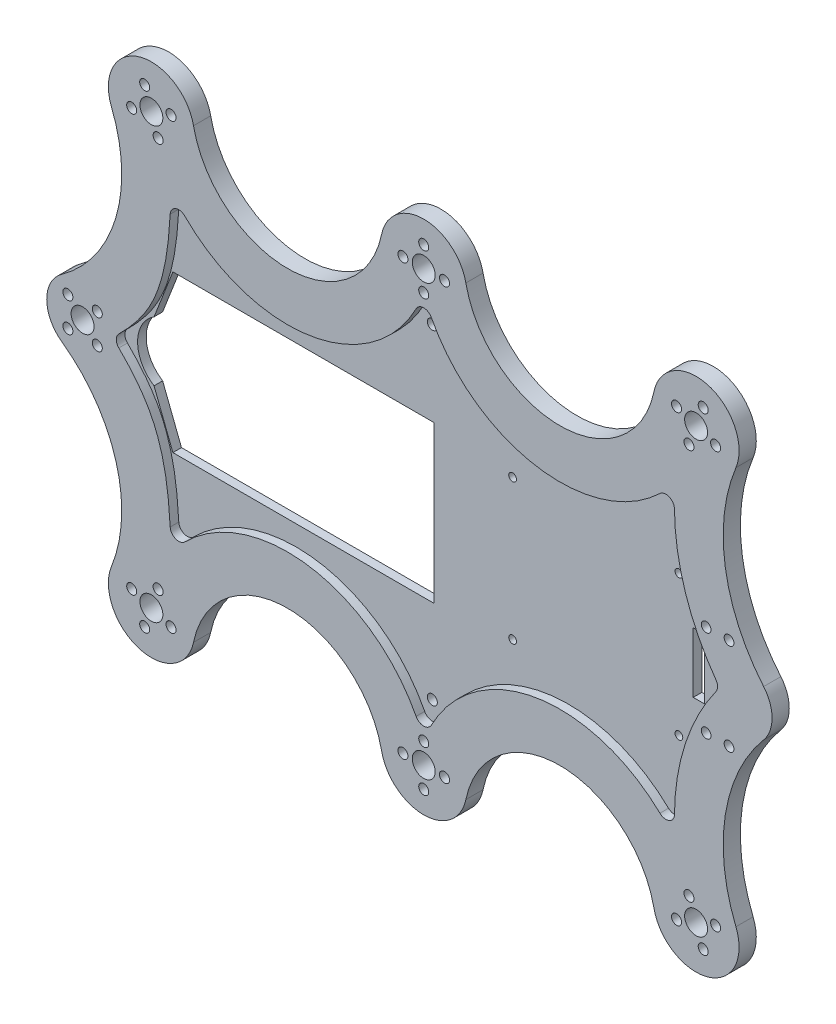
from build123d import *

# Parameters (mm, degrees)
BOSS_EXTRUDE1_DEPTH = 6
SKETCH3_R           = 2.2
SKETCH3_R_2         = 1.75
SKETCH3_R_3         = 1.7
CUT_EXTRUDE1_DEPTH  = 328.881898321
SKETCH4_R           = 1.75
SKETCH4_R_2         = 4
SKETCH4_R_3         = 2.2
SKETCH4_R_4         = 1.7
CUT_EXTRUDE2_DEPTH  = 328.881898321
SKETCH7_R           = 1.75
CUT_EXTRUDE3_DEPTH  = 3
SKETCH8_R           = 1.75
CUT_EXTRUDE4_DEPTH  = 328.881898461
BOSS_EXTRUDE2_DEPTH = 3
SKETCH12_W          = 68
SKETCH12_H          = 54.6
CUT_EXTRUDE5_DEPTH  = 328.840722513
SKETCH13_W          = 14
SKETCH13_H          = 54.6
CUT_EXTRUDE6_DEPTH  = 328.840722513
SKETCH14_W          = 4
SKETCH14_H          = 21
CUT_EXTRUDE7_DEPTH  = 328.840722513
SKETCH15_R          = 1.35
CUT_EXTRUDE8_DEPTH  = 328.840722513
SKETCH16_W          = 9.01
SKETCH16_H          = 54.6
CUT_EXTRUDE9_DEPTH  = 328.840722513
CUT_EXTRUDE10_DEPTH = 10
CUT_EXTRUDE11_DEPTH = 10


with BuildPart() as part:
    # Sketch2 → Boss-Extrude1 (new body)
    with BuildSketch(Plane.XY):
        with BuildLine():
            ThreePointArc((70.488766635, -192.322090702), (73.427413041, -184.270350675), (70.488766635, -176.218610648))
            ThreePointArc((70.488766635, -176.218610648), (57.116456448, -146.921490333), (60.81858321, -114.930332244))
            ThreePointArc((60.81858321, -114.930332244), (51.290904104, -94.919046005), (32.236691392, -106.240054086))
            ThreePointArc((32.236691392, -106.240054086), (-0.572586959, -132.972391704), (-33.381865309, -106.240054086))
            ThreePointArc((-33.381865309, -106.240054086), (-48.072586959, -94.270350675), (-62.763308608, -106.240054086))
            ThreePointArc((-62.763308608, -106.240054086), (-95.572586959, -132.972391704), (-128.381865309, -106.240054086))
            ThreePointArc((-128.381865309, -106.240054086), (-147.391756294, -94.905644752), (-156.998435737, -114.844463682))
            ThreePointArc((-156.998435737, -114.844463682), (-155.431011301, -147.469607154), (-174.3416559, -174.101248614))
            ThreePointArc((-174.3416559, -174.101248614), (-179.572586959, -184.270350675), (-174.3416559, -194.439452736))
            ThreePointArc((-174.3416559, -194.439452736), (-155.431011301, -221.071094196), (-156.998435737, -253.696237669))
            ThreePointArc((-156.998435737, -253.696237669), (-147.391756294, -273.635056598), (-128.381865309, -262.300647264))
            ThreePointArc((-128.381865309, -262.300647264), (-95.572586959, -235.568309646), (-62.763308608, -262.300647264))
            ThreePointArc((-62.763308608, -262.300647264), (-48.072586959, -274.270350675), (-33.381865309, -262.300647264))
            ThreePointArc((-33.381865309, -262.300647264), (-0.572586959, -235.568309646), (32.236691392, -262.300647264))
            ThreePointArc((32.236691392, -262.300647264), (51.290904104, -273.621655346), (60.81858321, -253.610369107))
            ThreePointArc((60.81858321, -253.610369107), (57.116456448, -221.619211017), (70.488766635, -192.322090702))
        make_face()
    extrude(amount=BOSS_EXTRUDE1_DEPTH)

    # Sketch3 → Cut-Extrude1 (cut, through all)
    with BuildSketch(Plane.XY.offset(6)):
        with Locations((-167.072586959, -184.270350675)):
            Circle(SKETCH3_R)
        with Locations((-143.072586959, -259.270350675)):
            Circle(SKETCH3_R)
        with Locations((-48.072586959, -259.270350675)):
            Circle(SKETCH3_R)
        with Locations((46.927413041, -259.270350675)):
            Circle(SKETCH3_R)
        with Locations((-67.072586959, -160.100350675)):
            Circle(SKETCH3_R_2)
        with Locations((-67.072586959, -208.440350675)):
            Circle(SKETCH3_R_2)
        with Locations((15.557413041, -208.440350675)):
            Circle(SKETCH3_R_2)
        with Locations((8.057413041, -160.100350675)):
            Circle(SKETCH3_R_2)
        with Locations((50.427413041, -168.270350675)):
            Circle(SKETCH3_R_3)
        with Locations((50.427413041, -200.270350675)):
            Circle(SKETCH3_R_3)
        with Locations((58.427413041, -200.270350675)):
            Circle(SKETCH3_R_3)
        with Locations((58.427413041, -168.270350675)):
            Circle(SKETCH3_R_3)
        with Locations((46.927413041, -109.270350675)):
            Circle(SKETCH3_R)
        with Locations((-48.072586959, -109.270350675)):
            Circle(SKETCH3_R)
        with Locations((-143.072586959, -109.270350675)):
            Circle(SKETCH3_R)
    extrude(amount=-CUT_EXTRUDE1_DEPTH, mode=Mode.SUBTRACT)

    # Sketch4 → Cut-Extrude2 (cut, through all)
    # profile 1 of 43: a face of its own
    with BuildSketch(Plane.XY.offset(6)):
        with BuildLine():
            ThreePointArc((-42.114282714, -235.355737603), (-5.549011021, -215.800259151), (34.005741621, -228.24442947))
            ThreePointArc((34.005741621, -228.24442947), (35.573505543, -228.475357635), (36.473534888, -227.171072886))
            ThreePointArc((36.473534888, -227.171072886), (40.669863544, -205.134788996), (50.819240898, -185.129861574))
            ThreePointArc((50.819240898, -185.129861574), (51.089915467, -184.270350675), (50.819240898, -183.410839777))
            ThreePointArc((50.819240898, -183.410839777), (40.669863544, -163.405912354), (36.473534888, -141.369628465))
            ThreePointArc((36.473534888, -141.369628465), (35.573505543, -140.065343716), (34.005741621, -140.29627188))
            ThreePointArc((34.005741621, -140.29627188), (-5.549011021, -152.740442199), (-42.114282714, -133.184963747))
            ThreePointArc((-42.114282714, -133.184963747), (-43.930158507, -132.119673393), (-45.998950752, -132.509990036))
            ThreePointArc((-45.998950752, -132.509990036), (-48.072586959, -133.089458954), (-50.146223165, -132.509990036))
            ThreePointArc((-50.146223165, -132.509990036), (-52.21501541, -132.119673393), (-54.030891203, -133.184963747))
            ThreePointArc((-54.030891203, -133.184963747), (-91.303570742, -152.801797294), (-131.222261476, -139.364129029))
            ThreePointArc((-131.222261476, -139.364129029), (-132.785071397, -139.092370085), (-133.717944996, -140.375325509))
            add(Edge.make_bspline(
                [(-133.717944996, -140.375325509), (-134.150081159, -144.596025582), (-134.890064199, -150.029341355), (-136.465860704, -157.254993303), (-137.828514545, -162.242085533), (-140.181217567, -168.681104247), (-143.498352334, -174.393407031), (-147.533291762, -179.36498976), (-149.943298535, -181.895276192), (-151.253989672, -183.218076256)],
                knots=[0, 0, 0, 0, 0.268528412, 0.346251537, 0.467777506, 0.595363013, 0.779092194, 0.882175473, 1, 1, 1, 1], degree=3))
            ThreePointArc((-151.253989672, -183.218076256), (-151.574900924, -183.701400569), (-151.688400698, -184.270350675))
            ThreePointArc((-151.688400698, -184.270350675), (-151.574900924, -184.839300782), (-151.253989672, -185.322625095))
            add(Edge.make_bspline(
                [(-133.717944996, -228.165375842), (-134.150081159, -223.944675768), (-134.890064199, -218.511359996), (-136.465860704, -211.285708047), (-137.828514545, -206.298615817), (-140.181217567, -199.859597104), (-143.498352334, -194.14729432), (-147.533291762, -189.175711591), (-149.943298535, -186.645425158), (-151.253989672, -185.322625095)],
                knots=[0, 0, 0, 0, 0.268528412, 0.346251537, 0.467777506, 0.595363013, 0.779092194, 0.882175473, 1, 1, 1, 1], degree=3))
            ThreePointArc((-133.717944996, -228.165375842), (-132.785071397, -229.448331266), (-131.222261476, -229.176572322))
            ThreePointArc((-131.222261476, -229.176572322), (-91.303570742, -215.738904057), (-54.030891203, -235.355737603))
            ThreePointArc((-54.030891203, -235.355737603), (-52.21501541, -236.421027958), (-50.146223165, -236.030711314))
            ThreePointArc((-50.146223165, -236.030711314), (-48.072586959, -235.451242396), (-45.998950752, -236.030711314))
            ThreePointArc((-45.998950752, -236.030711314), (-43.930158507, -236.421027958), (-42.114282714, -235.355737603))
        make_face()
        with Locations((-67.072586959, -208.440350675)):
            Circle(SKETCH4_R, mode=Mode.SUBTRACT)
        with Locations((15.557413041, -208.440350675)):
            Circle(SKETCH4_R, mode=Mode.SUBTRACT)
        with Locations((-67.072586959, -160.100350675)):
            Circle(SKETCH4_R, mode=Mode.SUBTRACT)
        with Locations((8.057413041, -160.100350675)):
            Circle(SKETCH4_R, mode=Mode.SUBTRACT)
    # profile 2 of 43: a face of its own
    with BuildSketch(Plane.XY.offset(6)):
        with Locations((-48.072586959, -109.270350675)):
            Circle(SKETCH4_R_2)
        with Locations((-48.072586959, -109.270350675)):
            Circle(SKETCH4_R_3, mode=Mode.SUBTRACT)
    # profile 3 of 43: a face of its own
    with BuildSketch(Plane.XY.offset(6)):
        with Locations((-40.822586959, -109.270350675)):
            Circle(SKETCH4_R)
    # profile 4 of 43: a face of its own
    with BuildSketch(Plane.XY.offset(6)):
        with Locations((-48.072586959, -116.520350675)):
            Circle(SKETCH4_R)
    # profile 5 of 43: a face of its own
    with BuildSketch(Plane.XY.offset(6)):
        with Locations((-55.322586959, -109.270350675)):
            Circle(SKETCH4_R)
    # profile 6 of 43: a face of its own
    with BuildSketch(Plane.XY.offset(6)):
        with Locations((-48.072586959, -102.020350675)):
            Circle(SKETCH4_R)
    # profile 7 of 43: a face of its own
    with BuildSketch(Plane.XY.offset(6)):
        with Locations((46.927413041, -109.270350675)):
            Circle(SKETCH4_R_2)
        with Locations((46.927413041, -109.270350675)):
            Circle(SKETCH4_R_3, mode=Mode.SUBTRACT)
    # profile 8 of 43: a face of its own
    with BuildSketch(Plane.XY.offset(6)):
        with Locations((53.737999615, -111.755991543)):
            Circle(SKETCH4_R)
    # profile 9 of 43: a face of its own
    with BuildSketch(Plane.XY.offset(6)):
        with Locations((49.413053909, -102.459764102)):
            Circle(SKETCH4_R)
    # profile 10 of 43: a face of its own
    with BuildSketch(Plane.XY.offset(6)):
        with Locations((40.116826468, -106.784709808)):
            Circle(SKETCH4_R)
    # profile 11 of 43: a face of its own
    with BuildSketch(Plane.XY.offset(6)):
        with Locations((44.441772174, -116.080937249)):
            Circle(SKETCH4_R)
    # profile 12 of 43: a face of its own
    with BuildSketch(Plane.XY.offset(6)):
        with Locations((50.427413041, -200.270350675)):
            Circle(SKETCH4_R_4)
    # profile 13 of 43: a face of its own
    with BuildSketch(Plane.XY.offset(6)):
        with Locations((58.427413041, -200.270350675)):
            Circle(SKETCH4_R_4)
    # profile 14 of 43: a face of its own
    with BuildSketch(Plane.XY.offset(6)):
        with Locations((50.427413041, -168.270350675)):
            Circle(SKETCH4_R_4)
    # profile 15 of 43: a face of its own
    with BuildSketch(Plane.XY.offset(6)):
        with Locations((58.427413041, -168.270350675)):
            Circle(SKETCH4_R_4)
    # profile 16 of 43: a face of its own
    with BuildSketch(Plane.XY.offset(6)):
        with Locations((49.413053909, -266.080937249)):
            Circle(SKETCH4_R)
    # profile 17 of 43: a face of its own
    with BuildSketch(Plane.XY.offset(6)):
        with Locations((46.927413041, -259.270350675)):
            Circle(SKETCH4_R_3)
    # profile 18 of 43: a face of its own
    with BuildSketch(Plane.XY.offset(6)):
        with Locations((53.737999615, -256.784709808)):
            Circle(SKETCH4_R)
    # profile 19 of 43: a face of its own
    with BuildSketch(Plane.XY.offset(6)):
        with Locations((44.441772174, -252.459764102)):
            Circle(SKETCH4_R)
    # profile 20 of 43: a face of its own
    with BuildSketch(Plane.XY.offset(6)):
        with Locations((40.116826468, -261.755991543)):
            Circle(SKETCH4_R)
    # profile 21 of 43: a face of its own
    with BuildSketch(Plane.XY.offset(6)):
        with Locations((-48.072586959, -259.270350675)):
            Circle(SKETCH4_R_2)
        with Locations((-48.072586959, -259.270350675)):
            Circle(SKETCH4_R_3, mode=Mode.SUBTRACT)
    # profile 22 of 43: a face of its own
    with BuildSketch(Plane.XY.offset(6)):
        with Locations((-40.822586959, -259.270350675)):
            Circle(SKETCH4_R)
    # profile 23 of 43: a face of its own
    with BuildSketch(Plane.XY.offset(6)):
        with Locations((-48.072586959, -252.020350675)):
            Circle(SKETCH4_R)
    # profile 24 of 43: a face of its own
    with BuildSketch(Plane.XY.offset(6)):
        with Locations((-55.322586959, -259.270350675)):
            Circle(SKETCH4_R)
    # profile 25 of 43: a face of its own
    with BuildSketch(Plane.XY.offset(6)):
        with Locations((-48.072586959, -266.520350675)):
            Circle(SKETCH4_R)
    # profile 26 of 43: a face of its own
    with BuildSketch(Plane.XY.offset(6)):
        with Locations((-143.072586959, -259.270350675)):
            Circle(SKETCH4_R_3)
    # profile 27 of 43: a face of its own
    with BuildSketch(Plane.XY.offset(6)):
        with Locations((-145.420081096, -266.129780045)):
            Circle(SKETCH4_R)
    # profile 28 of 43: a face of its own
    with BuildSketch(Plane.XY.offset(6)):
        with Locations((-136.213157589, -261.617844813)):
            Circle(SKETCH4_R)
    # profile 29 of 43: a face of its own
    with BuildSketch(Plane.XY.offset(6)):
        with Locations((-149.932016328, -256.922856538)):
            Circle(SKETCH4_R)
    # profile 30 of 43: a face of its own
    with BuildSketch(Plane.XY.offset(6)):
        with Locations((-140.725092821, -252.410921306)):
            Circle(SKETCH4_R)
    # profile 31 of 43: a face of its own
    with BuildSketch(Plane.XY.offset(6)):
        with Locations((-167.072586959, -184.270350675)):
            Circle(SKETCH4_R_2)
        with Locations((-167.072586959, -184.270350675)):
            Circle(SKETCH4_R_3, mode=Mode.SUBTRACT)
    # profile 32 of 43: a face of its own
    with BuildSketch(Plane.XY.offset(6)):
        with Locations((-161.946062795, -189.396874839)):
            Circle(SKETCH4_R)
    # profile 33 of 43: a face of its own
    with BuildSketch(Plane.XY.offset(6)):
        with Locations((-172.199111122, -189.396874839)):
            Circle(SKETCH4_R)
    # profile 34 of 43: a face of its own
    with BuildSketch(Plane.XY.offset(6)):
        with Locations((-172.199111122, -179.143826512)):
            Circle(SKETCH4_R)
    # profile 35 of 43: a face of its own
    with BuildSketch(Plane.XY.offset(6)):
        with Locations((-161.946062795, -179.143826512)):
            Circle(SKETCH4_R)
    # profile 36 of 43: a face of its own
    with BuildSketch(Plane.XY.offset(6)):
        with Locations((-143.072586959, -109.270350675)):
            Circle(SKETCH4_R_3)
    # profile 37 of 43: a face of its own
    with BuildSketch(Plane.XY.offset(6)):
        with Locations((-136.213157589, -106.922856538)):
            Circle(SKETCH4_R)
    # profile 38 of 43: a face of its own
    with BuildSketch(Plane.XY.offset(6)):
        with Locations((-140.725092821, -116.129780045)):
            Circle(SKETCH4_R)
    # profile 39 of 43: a face of its own
    with BuildSketch(Plane.XY.offset(6)):
        with Locations((-149.932016328, -111.617844813)):
            Circle(SKETCH4_R)
    # profile 40 of 43: a face of its own
    with BuildSketch(Plane.XY.offset(6)):
        with Locations((-145.420081096, -102.410921306)):
            Circle(SKETCH4_R)
    # profile 41 of 43: a face of its own
    with BuildSketch(Plane.XY.offset(6)):
        with Locations((46.927413041, -259.270350675)):
            Circle(SKETCH4_R_2)
    # profile 42 of 43: a face of its own
    with BuildSketch(Plane.XY.offset(6)):
        with Locations((-143.072586959, -259.270350675)):
            Circle(SKETCH4_R_2)
    # profile 43 of 43: a face of its own
    with BuildSketch(Plane.XY.offset(6)):
        with Locations(Location((-143.072586959, -109.270350675, 0), (0, 0, 180))):
            Circle(SKETCH4_R_2)
    extrude(amount=-CUT_EXTRUDE2_DEPTH, mode=Mode.SUBTRACT)

    # Sketch7 → Cut-Extrude3 (cut)
    with BuildSketch(Plane.XY.offset(6)):
        with BuildLine():
            ThreePointArc((-50.73613836, -122.70906266), (-87.921705153, -149.389463008), (-131.391210624, -135.071214701))
            ThreePointArc((-131.391210624, -135.071214701), (-134.587884876, -134.382856727), (-136.514716025, -137.024803869))
            add(Edge.make_bspline(
                [(-136.514716025, -137.024803869), (-136.6876318, -140.228167966), (-137.099314035, -145.525482827), (-138.447240023, -154.27704652), (-140.500979816, -161.944563398), (-144.043881316, -169.46797042), (-148.488947014, -175.90587126), (-152.252706039, -179.991313531), (-154.418853268, -182.140350675)],
                knots=[0, 0, 0, 0, 0.192810912, 0.318881815, 0.531898802, 0.666882913, 0.816627803, 1, 1, 1, 1], degree=3))
            ThreePointArc((-154.418853268, -182.140350675), (-155.306248241, -184.270350675), (-154.418853268, -186.400350675))
            add(Edge.make_bspline(
                [(-136.514716025, -231.515897481), (-136.6876318, -228.312533384), (-137.099314035, -223.015218523), (-138.447240023, -214.263654831), (-140.500979816, -206.596137953), (-144.043881316, -199.072730931), (-148.488947014, -192.634830091), (-152.252706039, -188.54938782), (-154.418853268, -186.400350675)],
                knots=[0, 0, 0, 0, 0.192810912, 0.318881815, 0.531898802, 0.666882913, 0.816627803, 1, 1, 1, 1], degree=3))
            ThreePointArc((-136.514716025, -231.515897481), (-134.587884876, -234.157844623), (-131.391210624, -233.46948665))
            ThreePointArc((-131.391210624, -233.46948665), (-87.921705153, -219.151238342), (-50.73613836, -245.831638691))
            ThreePointArc((-50.73613836, -245.831638691), (-48.072586959, -247.451242396), (-45.409035557, -245.831638691))
            ThreePointArc((-45.409035557, -245.831638691), (-8.868638837, -219.254400713), (34.312991539, -232.554662706))
            ThreePointArc((34.312991539, -232.554662706), (37.55487994, -233.148200848), (39.385321958, -230.407469202))
            ThreePointArc((39.385321958, -230.407469202), (43.179729567, -207.090690664), (53.864451519, -186.021604131))
            ThreePointArc((53.864451519, -186.021604131), (54.428653634, -184.270350675), (53.864451519, -182.519097219))
            ThreePointArc((53.864451519, -182.519097219), (43.179729567, -161.450010687), (39.385321958, -138.133232148))
            ThreePointArc((39.385321958, -138.133232148), (37.55487994, -135.392500502), (34.312991539, -135.986038645))
            ThreePointArc((34.312991539, -135.986038645), (-8.868638837, -149.286300638), (-45.409035557, -122.70906266))
            ThreePointArc((-45.409035557, -122.70906266), (-48.072586959, -121.089458954), (-50.73613836, -122.70906266))
        make_face()
        with Locations((-48.072586959, -127.589458954)):
            Circle(SKETCH7_R, mode=Mode.SUBTRACT)
        with Locations((-48.072586959, -240.951242396)):
            Circle(SKETCH7_R, mode=Mode.SUBTRACT)
    extrude(amount=-CUT_EXTRUDE3_DEPTH, mode=Mode.SUBTRACT)

    # Sketch8 → Cut-Extrude4 (cut, through all)
    with BuildSketch(Plane.XY.offset(6)):
        with Locations((-48.072586959, -240.951242396)):
            Circle(SKETCH8_R)
        with Locations((-48.072586959, -127.589458954)):
            Circle(SKETCH8_R)
    extrude(amount=-CUT_EXTRUDE4_DEPTH, mode=Mode.SUBTRACT)

    # Sketch9 → Boss-Extrude2 (add)
    with BuildSketch(Plane.XY.offset(3)):
        Polygon((-133.717944996, -228.165375842), (-151.253989672, -185.322625095), (-152.763632028, -183.447514351), (-134.317373659, -138.092993713), (-41.049874195, -131.010490082), (36.976966738, -138.092993713), (52.551226604, -183.447514351), (36.976966738, -231.287523), (-43.975713991, -237.434869701), (-133.519049653, -231.354705086), align=None)
    extrude(amount=-BOSS_EXTRUDE2_DEPTH)

    # Sketch12 → Cut-Extrude5 (cut, through all)
    with BuildSketch(Plane.XY.offset(3)):
        with Locations((-104.572586959, -184.270350675)):
            Rectangle(SKETCH12_W, SKETCH12_H)
    extrude(amount=-CUT_EXTRUDE5_DEPTH, mode=Mode.SUBTRACT)

    # Sketch13 → Cut-Extrude6 (cut, through all)
    with BuildSketch(Plane.XY.offset(3)):
        with Locations((-63.572586959, -184.270350675)):
            Rectangle(SKETCH13_W, SKETCH13_H)
    extrude(amount=-CUT_EXTRUDE6_DEPTH, mode=Mode.SUBTRACT)

    # Sketch14 → Cut-Extrude7 (cut, through all)
    with BuildSketch(Plane.XY.offset(3)):
        with Locations((44.927413041, -184.270350675)):
            Rectangle(SKETCH14_W, SKETCH14_H)
    extrude(amount=-CUT_EXTRUDE7_DEPTH, mode=Mode.SUBTRACT)

    # Sketch15 → Cut-Extrude8 (cut, through all)
    with BuildSketch(Plane.XY.offset(3)):
        with Locations((37.927413041, -159.770350675)):
            Circle(SKETCH15_R)
        with Locations((37.927413041, -208.770350675)):
            Circle(SKETCH15_R)
        with Locations((-20.074205819, -208.770350675)):
            Circle(SKETCH15_R)
        with Locations((-20.074205819, -159.770350675)):
            Circle(SKETCH15_R)
    extrude(amount=-CUT_EXTRUDE8_DEPTH, mode=Mode.SUBTRACT)

    # Sketch16 → Cut-Extrude9 (cut, through all)
    with BuildSketch(Plane.XY.offset(3)):
        with Locations((-52.067586959, -184.270350675)):
            Rectangle(SKETCH16_W, SKETCH16_H)
    extrude(amount=-CUT_EXTRUDE9_DEPTH, mode=Mode.SUBTRACT)

    # Sketch17 → Cut-Extrude10 (cut)
    with BuildSketch(Plane.XY.offset(3)):
        with BuildLine():
            Line((-138.572586959, -171.96263846), (-138.572586959, -196.57806289))
            ThreePointArc((-138.572586959, -196.57806289), (-150.880299174, -184.270350675), (-138.572586959, -171.96263846))
        make_face()
    extrude(amount=-CUT_EXTRUDE10_DEPTH, mode=Mode.SUBTRACT)

    # Sketch18 → Cut-Extrude11 (cut)
    with BuildSketch(Plane.XY.offset(3)):
        Polygon((-138.572586959, -211.570350675), (-145.141360535, -194.678568278), (-138.572586959, -194.678568278), align=None)
        Polygon((-138.572586959, -173.862133073), (-138.572586959, -156.970350675), (-145.141360535, -173.862133073), align=None)
    extrude(amount=-CUT_EXTRUDE11_DEPTH, mode=Mode.SUBTRACT)


solid = part.part
